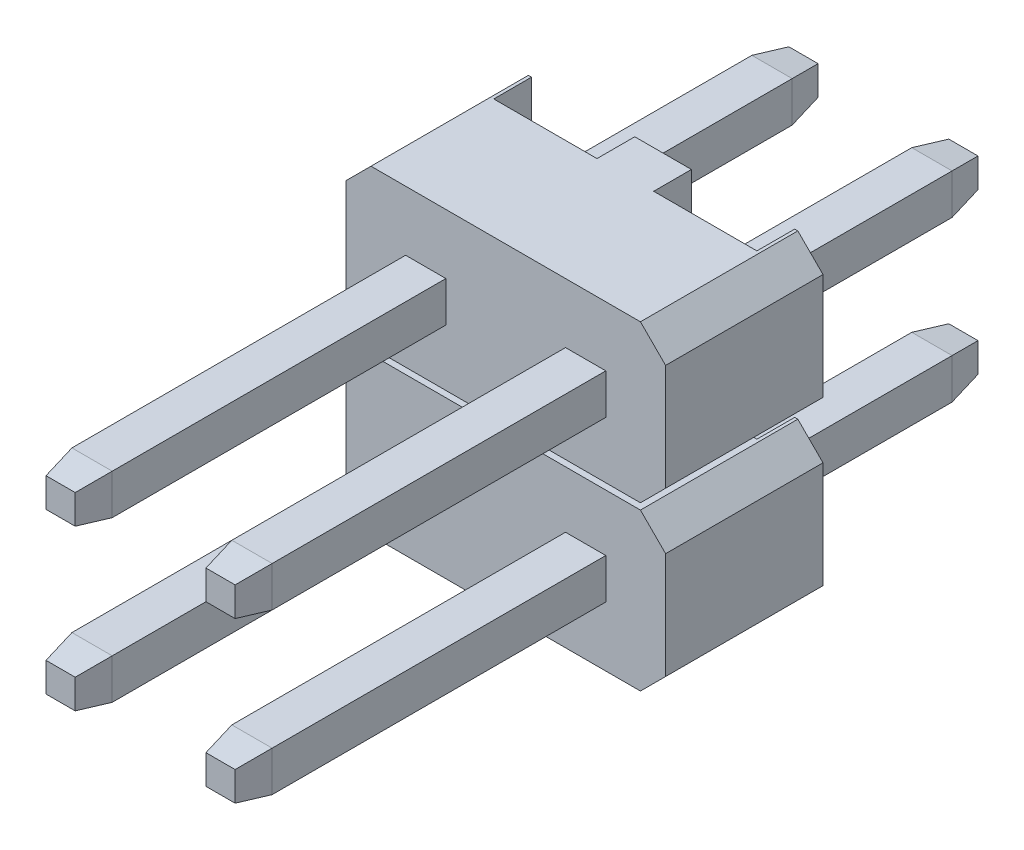
from build123d import *

# Parameters (mm, degrees)
SKETCH1_W                     = 0.64
SKETCH1_H                     = 0.64
BOSS_EXTRUDE1_DEPTH           = 5.3
BOSS_EXTRUDE1_2_DEPTH         = 5.3
BOSS_EXTRUDE1_3_DEPTH         = 5.3
BOSS_EXTRUDE1_4_DEPTH         = 5.3
SKETCH2_W                     = 0.64
SKETCH2_H                     = 0.64
BOSS_EXTRUDE2_DEPTH           = 0.5
BOSS_EXTRUDE2_DRAFT           = 10
BOSS_EXTRUDE2_PROFILE_2_DEPTH = 0.5
BOSS_EXTRUDE2_PROFILE_2_DRAFT = 10
BOSS_EXTRUDE2_PROFILE_3_DEPTH = 0.5
BOSS_EXTRUDE2_PROFILE_3_DRAFT = 10
BOSS_EXTRUDE2_PROFILE_4_DEPTH = 0.5
BOSS_EXTRUDE2_PROFILE_4_DRAFT = 10
BOSS_EXTRUDE3_DEPTH           = 2.5
SKETCH5_W                     = 1.64
SKETCH5_H                     = 5.08
CUT_EXTRUDE1_DEPTH            = 0.6
SKETCH6_W                     = 5.08
SKETCH6_H                     = 0.1
CUT_EXTRUDE2_DEPTH            = 7.822257691
CUT_EXTRUDE3_DEPTH            = 7.822257691
SKETCH8_W                     = 0.64
SKETCH8_H                     = 0.64
BOSS_EXTRUDE4_DEPTH           = 3.6
BOSS_EXTRUDE4_2_DEPTH         = 3.6
BOSS_EXTRUDE4_3_DEPTH         = 3.6
BOSS_EXTRUDE4_4_DEPTH         = 3.6
SKETCH9_W                     = 0.64
SKETCH9_H                     = 0.64
BOSS_EXTRUDE5_DEPTH           = 0.5
BOSS_EXTRUDE5_DRAFT           = 10
BOSS_EXTRUDE5_PROFILE_2_DEPTH = 0.5
BOSS_EXTRUDE5_PROFILE_2_DRAFT = 10
BOSS_EXTRUDE5_PROFILE_3_DEPTH = 0.5
BOSS_EXTRUDE5_PROFILE_3_DRAFT = 10
BOSS_EXTRUDE5_PROFILE_4_DEPTH = 0.5
BOSS_EXTRUDE5_PROFILE_4_DRAFT = 10


with BuildPart() as part:
    # Sketch1 → Boss-Extrude1 (new body)
    with BuildSketch(Plane.XY):
        with Locations((-1.27, 1.27)):
            Rectangle(SKETCH1_W, SKETCH1_H)
    extrude(amount=BOSS_EXTRUDE1_DEPTH)


with BuildPart() as body_2:
    # Sketch1 → Boss-Extrude1 2 (new body)
    with BuildSketch(Plane.XY):
        with Locations((-1.27, -1.27)):
            Rectangle(SKETCH1_W, SKETCH1_H)
    extrude(amount=BOSS_EXTRUDE1_2_DEPTH)


with BuildPart() as body_3:
    # Sketch1 → Boss-Extrude1 3 (new body)
    with BuildSketch(Plane.XY):
        with Locations((1.27, 1.27)):
            Rectangle(SKETCH1_W, SKETCH1_H)
    extrude(amount=BOSS_EXTRUDE1_3_DEPTH)


with BuildPart() as body_4:
    # Sketch1 → Boss-Extrude1 4 (new body)
    with BuildSketch(Plane.XY):
        with Locations((1.27, -1.27)):
            Rectangle(SKETCH1_W, SKETCH1_H)
    extrude(amount=BOSS_EXTRUDE1_4_DEPTH)


with BuildPart() as boss_extrude2_tool:
    # Sketch2 → Boss-Extrude2 (with draft: the straight prism first)
    with BuildSketch(Plane.XY.offset(5.3)):
        with Locations((-1.27, -1.27)):
            Rectangle(SKETCH2_W, SKETCH2_H)
    extrude(amount=BOSS_EXTRUDE2_DEPTH)
    # Boss-Extrude2: the draft: its side faces are tilted about the plane it starts from
    boss_extrude2_sides = [boss_extrude2_tool.faces().sort_by_distance(p)[0] for p in [
        (-1.59, -1.27, 5.55),
        (-1.27, -1.59, 5.55),
        (-0.95, -1.27, 5.55),
        (-1.27, -0.95, 5.55),
    ]]
    draft(boss_extrude2_sides, Plane.XY.offset(5.3), BOSS_EXTRUDE2_DRAFT)


with BuildPart() as part_1:
    add(part.part)

    # Boss-Extrude2: add boss_extrude2_tool
    add(boss_extrude2_tool.part)

    add(body_2.part)  # Boss-Extrude2 merges body 2

    add(body_3.part)  # Boss-Extrude2 merges body 3

    add(body_4.part)  # Boss-Extrude2 merges body 4


with BuildPart() as boss_extrude2_profile_2_tool:
    # Sketch2 → Boss-Extrude2 profile 2 (with draft: the straight prism first)
    with BuildSketch(Plane.XY.offset(5.3)):
        with Locations((-1.27, 1.27)):
            Rectangle(SKETCH2_W, SKETCH2_H)
    extrude(amount=BOSS_EXTRUDE2_PROFILE_2_DEPTH)
    # Boss-Extrude2 profile 2: the draft: its side faces are tilted about the plane it starts from
    boss_extrude2_profile_2_sides = [boss_extrude2_profile_2_tool.faces().sort_by_distance(p)[0] for p in [
        (-1.59, 1.27, 5.55),
        (-1.27, 0.95, 5.55),
        (-0.95, 1.27, 5.55),
        (-1.27, 1.59, 5.55),
    ]]
    draft(boss_extrude2_profile_2_sides, Plane.XY.offset(5.3), BOSS_EXTRUDE2_PROFILE_2_DRAFT)


with BuildPart() as part_2:
    add(part_1.part)

    # Boss-Extrude2 profile 2: add boss_extrude2_profile_2_tool
    add(boss_extrude2_profile_2_tool.part)


with BuildPart() as boss_extrude2_profile_3_tool:
    # Sketch2 → Boss-Extrude2 profile 3 (with draft: the straight prism first)
    with BuildSketch(Plane.XY.offset(5.3)):
        with Locations((1.27, -1.27)):
            Rectangle(SKETCH2_W, SKETCH2_H)
    extrude(amount=BOSS_EXTRUDE2_PROFILE_3_DEPTH)
    # Boss-Extrude2 profile 3: the draft: its side faces are tilted about the plane it starts from
    boss_extrude2_profile_3_sides = [boss_extrude2_profile_3_tool.faces().sort_by_distance(p)[0] for p in [
        (1.59, -1.27, 5.55),
        (1.27, -0.95, 5.55),
        (0.95, -1.27, 5.55),
        (1.27, -1.59, 5.55),
    ]]
    draft(boss_extrude2_profile_3_sides, Plane.XY.offset(5.3), BOSS_EXTRUDE2_PROFILE_3_DRAFT)


with BuildPart() as part_3:
    add(part_2.part)

    # Boss-Extrude2 profile 3: add boss_extrude2_profile_3_tool
    add(boss_extrude2_profile_3_tool.part)


with BuildPart() as boss_extrude2_profile_4_tool:
    # Sketch2 → Boss-Extrude2 profile 4 (with draft: the straight prism first)
    with BuildSketch(Plane.XY.offset(5.3)):
        with Locations((1.27, 1.27)):
            Rectangle(SKETCH2_W, SKETCH2_H)
    extrude(amount=BOSS_EXTRUDE2_PROFILE_4_DEPTH)
    # Boss-Extrude2 profile 4: the draft: its side faces are tilted about the plane it starts from
    boss_extrude2_profile_4_sides = [boss_extrude2_profile_4_tool.faces().sort_by_distance(p)[0] for p in [
        (1.59, 1.27, 5.55),
        (1.27, 1.59, 5.55),
        (0.95, 1.27, 5.55),
        (1.27, 0.95, 5.55),
    ]]
    draft(boss_extrude2_profile_4_sides, Plane.XY.offset(5.3), BOSS_EXTRUDE2_PROFILE_4_DRAFT)


with BuildPart() as part_4:
    add(part_3.part)

    # Boss-Extrude2 profile 4: add boss_extrude2_profile_4_tool
    add(boss_extrude2_profile_4_tool.part)


with BuildPart() as body_2_2:
    # Sketch3 → Boss-Extrude3 (new body)
    with BuildSketch(Plane.XY):
        Polygon((-2.14, 2.54), (2.14, 2.54), (2.54, 2.14), (2.54, -2.14), (2.14, -2.54), (-2.14, -2.54), (-2.54, -2.14), (-2.54, 2.14), align=None)
    extrude(amount=-BOSS_EXTRUDE3_DEPTH)

    # Sketch5 → Cut-Extrude1 (cut)
    with BuildSketch(Plane(origin=(0, 0, -2.5), x_dir=(-1, 0, 0), z_dir=(0, 0, -1))):
        with Locations((-1.27, 0)):
            Rectangle(SKETCH5_W, SKETCH5_H)
        with Locations((1.27, 0)):
            Rectangle(SKETCH5_W, SKETCH5_H)
    extrude(amount=-CUT_EXTRUDE1_DEPTH, mode=Mode.SUBTRACT)

    # Sketch6 → Cut-Extrude2 (cut, through all)
    with BuildSketch(Plane.XY):
        Rectangle(SKETCH6_W, SKETCH6_H)
    extrude(amount=-CUT_EXTRUDE2_DEPTH, mode=Mode.SUBTRACT)


with BuildPart() as cut_extrude2_piece_1:
    # of the separate pieces the step leaves, piece 1, a body of its own (cut_extrude2_pieces)
    add(body_2_2.part.solids().sort_by_distance((-2.14, 2.54, 0))[0])


with BuildPart() as cut_extrude2_piece_2:
    # of the separate pieces the step leaves, piece 2, a body of its own (cut_extrude2_pieces)
    add(body_2_2.part.solids().sort_by_distance((-2.54, -2.14, 0))[0])


with BuildPart() as cut_extrude3_tool:
    # Sketch7 → Cut-Extrude3 (new, through all)
    with BuildSketch(Plane.XY):
        Polygon((2.54, 0.45), (2.14, 0.05), (2.54, 0.05), align=None)
        Polygon((2.54, -0.05), (2.14, -0.05), (2.54, -0.45), align=None)
        Polygon((-2.54, -0.45), (-2.54, -0.05), (-2.14, -0.05), align=None)
        Polygon((-2.54, 0.05), (-2.54, 0.45), (-2.14, 0.05), align=None)
    extrude(amount=-CUT_EXTRUDE3_DEPTH)


with BuildPart() as cut_extrude2_piece_1_1:
    add(cut_extrude2_piece_1.part)

    # Cut-Extrude3: cut by cut_extrude3_tool
    add(cut_extrude3_tool.part, mode=Mode.SUBTRACT)


with BuildPart() as cut_extrude2_piece_2_1:
    add(cut_extrude2_piece_2.part)

    # Cut-Extrude3: cut by cut_extrude3_tool
    add(cut_extrude3_tool.part, mode=Mode.SUBTRACT)


with BuildPart() as body_4_2:
    # Sketch8 → Boss-Extrude4 (new body)
    with BuildSketch(Plane(origin=(0, 0, -1.9), x_dir=(-1, 0, 0), z_dir=(0, 0, -1))):
        with Locations((1.27, -1.27)):
            Rectangle(SKETCH8_W, SKETCH8_H)
    extrude(amount=BOSS_EXTRUDE4_DEPTH)


with BuildPart() as body_5:
    # Sketch8 → Boss-Extrude4 2 (new body)
    with BuildSketch(Plane(origin=(0, 0, -1.9), x_dir=(-1, 0, 0), z_dir=(0, 0, -1))):
        with Locations((1.27, 1.27)):
            Rectangle(SKETCH8_W, SKETCH8_H)
    extrude(amount=BOSS_EXTRUDE4_2_DEPTH)


with BuildPart() as body_6:
    # Sketch8 → Boss-Extrude4 3 (new body)
    with BuildSketch(Plane(origin=(0, 0, -1.9), x_dir=(-1, 0, 0), z_dir=(0, 0, -1))):
        with Locations((-1.27, 1.27)):
            Rectangle(SKETCH8_W, SKETCH8_H)
    extrude(amount=BOSS_EXTRUDE4_3_DEPTH)


with BuildPart() as body_7:
    # Sketch8 → Boss-Extrude4 4 (new body)
    with BuildSketch(Plane(origin=(0, 0, -1.9), x_dir=(-1, 0, 0), z_dir=(0, 0, -1))):
        with Locations((-1.27, -1.27)):
            Rectangle(SKETCH8_W, SKETCH8_H)
    extrude(amount=BOSS_EXTRUDE4_4_DEPTH)


with BuildPart() as boss_extrude5_tool:
    # Sketch9 → Boss-Extrude5 (with draft: the straight prism first)
    with BuildSketch(Plane(origin=(0, 0, -5.5), x_dir=(-1, 0, 0), z_dir=(0, 0, -1))):
        with Locations((1.27, 1.27)):
            Rectangle(SKETCH9_W, SKETCH9_H)
    extrude(amount=BOSS_EXTRUDE5_DEPTH)
    # Boss-Extrude5: the draft: its side faces are tilted about the plane it starts from
    boss_extrude5_sides = [boss_extrude5_tool.faces().sort_by_distance(p)[0] for p in [
        (-0.95, 1.27, -5.75),
        (-1.27, 0.95, -5.75),
        (-1.59, 1.27, -5.75),
        (-1.27, 1.59, -5.75),
    ]]
    draft(boss_extrude5_sides, Plane(origin=(0, 0, -5.5), x_dir=(-1, 0, 0), z_dir=(0, 0, -1)), BOSS_EXTRUDE5_DRAFT)


with BuildPart() as body_5_1:
    add(body_5.part)

    # Boss-Extrude5: add boss_extrude5_tool
    add(boss_extrude5_tool.part)

    add(body_4_2.part)  # Boss-Extrude5 merges body 4 2

    add(body_7.part)  # Boss-Extrude5 merges body 7

    add(body_6.part)  # Boss-Extrude5 merges body 6


with BuildPart() as boss_extrude5_profile_2_tool:
    # Sketch9 → Boss-Extrude5 profile 2 (with draft: the straight prism first)
    with BuildSketch(Plane(origin=(0, 0, -5.5), x_dir=(-1, 0, 0), z_dir=(0, 0, -1))):
        with Locations((1.27, -1.27)):
            Rectangle(SKETCH9_W, SKETCH9_H)
    extrude(amount=BOSS_EXTRUDE5_PROFILE_2_DEPTH)
    # Boss-Extrude5 profile 2: the draft: its side faces are tilted about the plane it starts from
    boss_extrude5_profile_2_sides = [boss_extrude5_profile_2_tool.faces().sort_by_distance(p)[0] for p in [
        (-1.59, -1.27, -5.75),
        (-1.27, -0.95, -5.75),
        (-0.95, -1.27, -5.75),
        (-1.27, -1.59, -5.75),
    ]]
    draft(boss_extrude5_profile_2_sides, Plane(origin=(0, 0, -5.5), x_dir=(-1, 0, 0), z_dir=(0, 0, -1)), BOSS_EXTRUDE5_PROFILE_2_DRAFT)


with BuildPart() as body_5_2:
    add(body_5_1.part)

    # Boss-Extrude5 profile 2: add boss_extrude5_profile_2_tool
    add(boss_extrude5_profile_2_tool.part)


with BuildPart() as boss_extrude5_profile_3_tool:
    # Sketch9 → Boss-Extrude5 profile 3 (with draft: the straight prism first)
    with BuildSketch(Plane(origin=(0, 0, -5.5), x_dir=(-1, 0, 0), z_dir=(0, 0, -1))):
        with Locations((-1.27, -1.27)):
            Rectangle(SKETCH9_W, SKETCH9_H)
    extrude(amount=BOSS_EXTRUDE5_PROFILE_3_DEPTH)
    # Boss-Extrude5 profile 3: the draft: its side faces are tilted about the plane it starts from
    boss_extrude5_profile_3_sides = [boss_extrude5_profile_3_tool.faces().sort_by_distance(p)[0] for p in [
        (1.59, -1.27, -5.75),
        (1.27, -1.59, -5.75),
        (0.95, -1.27, -5.75),
        (1.27, -0.95, -5.75),
    ]]
    draft(boss_extrude5_profile_3_sides, Plane(origin=(0, 0, -5.5), x_dir=(-1, 0, 0), z_dir=(0, 0, -1)), BOSS_EXTRUDE5_PROFILE_3_DRAFT)


with BuildPart() as body_5_3:
    add(body_5_2.part)

    # Boss-Extrude5 profile 3: add boss_extrude5_profile_3_tool
    add(boss_extrude5_profile_3_tool.part)


with BuildPart() as boss_extrude5_profile_4_tool:
    # Sketch9 → Boss-Extrude5 profile 4 (with draft: the straight prism first)
    with BuildSketch(Plane(origin=(0, 0, -5.5), x_dir=(-1, 0, 0), z_dir=(0, 0, -1))):
        with Locations((-1.27, 1.27)):
            Rectangle(SKETCH9_W, SKETCH9_H)
    extrude(amount=BOSS_EXTRUDE5_PROFILE_4_DEPTH)
    # Boss-Extrude5 profile 4: the draft: its side faces are tilted about the plane it starts from
    boss_extrude5_profile_4_sides = [boss_extrude5_profile_4_tool.faces().sort_by_distance(p)[0] for p in [
        (0.95, 1.27, -5.75),
        (1.27, 1.59, -5.75),
        (1.59, 1.27, -5.75),
        (1.27, 0.95, -5.75),
    ]]
    draft(boss_extrude5_profile_4_sides, Plane(origin=(0, 0, -5.5), x_dir=(-1, 0, 0), z_dir=(0, 0, -1)), BOSS_EXTRUDE5_PROFILE_4_DRAFT)


with BuildPart() as body_5_4:
    add(body_5_3.part)

    # Boss-Extrude5 profile 4: add boss_extrude5_profile_4_tool
    add(boss_extrude5_profile_4_tool.part)


solid = Compound([part_4.part, cut_extrude2_piece_1_1.part, cut_extrude2_piece_2_1.part, body_5_4.part])
